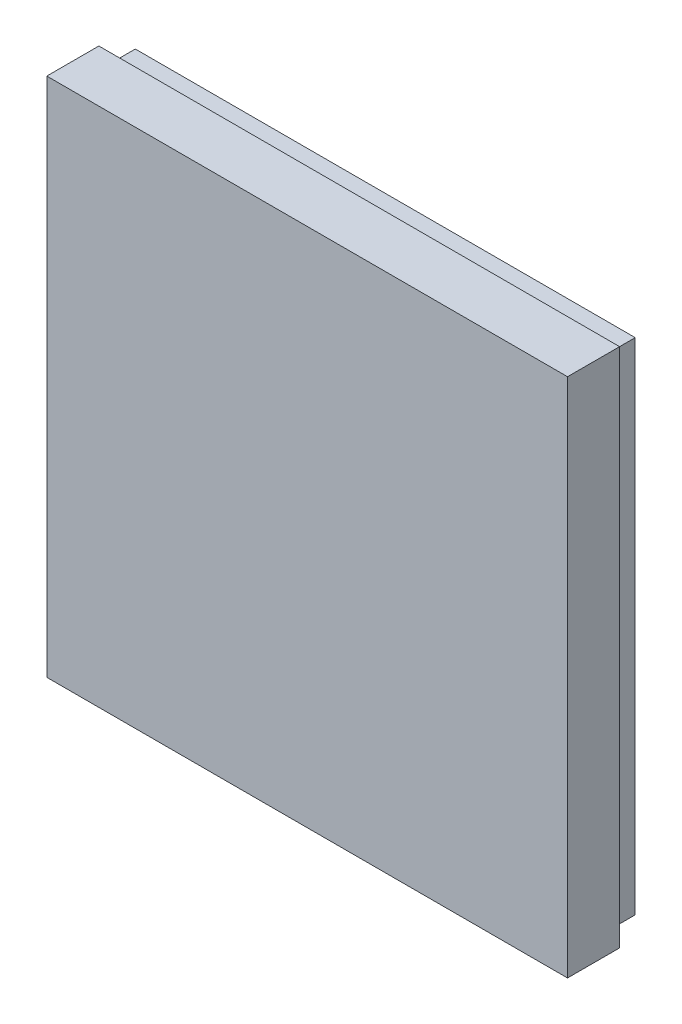
from build123d import *

# Parameters (mm, degrees)
SKETCH1_W           = 100
SKETCH1_H           = 100
BOSS_EXTRUDE1_DEPTH = 10
SKETCH2_W           = 96
SKETCH2_H           = 96
BOSS_EXTRUDE2_DEPTH = 5


with BuildPart() as part:
    # Sketch1 → Boss-Extrude1 (new body)
    with BuildSketch(Plane.XY):
        with Locations((-25.847143135, -19.542285387)):
            Rectangle(SKETCH1_W, SKETCH1_H)
    extrude(amount=BOSS_EXTRUDE1_DEPTH)

    # Sketch2 → Boss-Extrude2 (add)
    with BuildSketch(Plane(origin=(0, 0, 0), x_dir=(-1, 0, 0), z_dir=(0, 0, -1))):
        with Locations((25.847143135, -19.542285387)):
            Rectangle(SKETCH2_W, SKETCH2_H)
    extrude(amount=BOSS_EXTRUDE2_DEPTH)


solid = part.part
